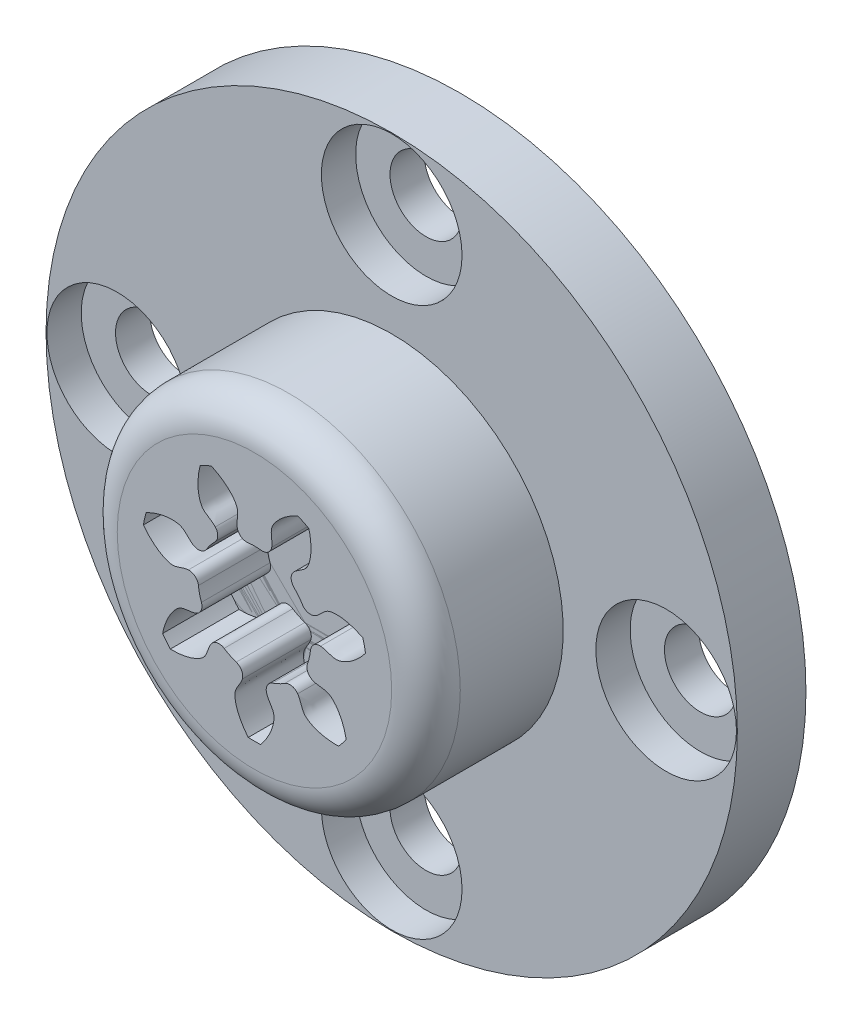
from build123d import *

# Parameters (mm, degrees)
SKETCH_1_R          = 3.285
LASHENA_DEPTH       = 7
CUT_EXTRUDEA_DEPTH  = 7
WWW_KYTOOL_CN_COUNT = 7
SKETCH_3_R          = 5
EXTRUDE_2_DEPTH     = 2
FILLET_1_R          = 1
SKETCH_5_R          = 5
EXTRUDE_3_DEPTH     = 2
SKETCH_7_R          = 10.075
EXTRUDE_4_DEPTH     = 2
SKETCH_8_R          = 1.05
CUT_EXTRUDE_1_DEPTH = 16.100041424
SKETCH_9_R          = 2.05
CUT_EXTRUDE_2_DEPTH = 1
SKETCH_10_R         = 1.05
CUT_EXTRUDE_3_DEPTH = 16.874862248


with BuildPart() as part:
    # 草图1 → LaShenA (new body)
    with BuildSketch(Plane.XY):
        Circle(SKETCH_1_R)
    extrude(amount=LASHENA_DEPTH)

    # SketchA → Cut-ExtrudeA (cut)
    with BuildSketch(Plane.XY.offset(7)):
        with BuildLine():
            ThreePointArc((0.196319602, 1.630725257), (0, 1.6425), (-0.196319602, 1.630725257))
            ThreePointArc((-0.196319602, 1.630725257), (-0.395918985, 1.684219021), (-0.503155758, 1.86085925))
            add(Edge.make_bspline(
                [(-0.503155758, 1.86085925), (-0.529680759, 2.021190092), (-0.456792288, 2.201008016), (-0.510421041, 2.369700657), (-0.518078681, 2.388563402), (-0.525675305, 2.405621476), (-0.535421722, 2.425419167), (-0.547506694, 2.447830289), (-0.562146915, 2.472697504), (-0.579538823, 2.499857985), (-0.599873849, 2.529135411), (-0.623332711, 2.560343137), (-0.650086483, 2.593283802), (-0.68029556, 2.627750094), (-0.714109307, 2.663525183), (-0.751665529, 2.700383298), (-0.793090025, 2.738090277), (-0.838496157, 2.776404166), (-0.887984442, 2.815075822), (-0.941642186, 2.853849544), (-0.999543129, 2.892463716), (-1.061747134, 2.93065147), (-1.128299902, 2.968141365), (-1.199232716, 3.004658075), (-1.274562224, 3.039923097), (-1.354290242, 3.073655461), (-1.438403621, 3.105572452), (-1.526874039, 3.135390364), (-1.652756718, 3.172611828), (-1.750320315, 3.195471796), (-1.816933587, 3.208547948)],
                knots=[0.126986057, 0.126986057, 0.126986057, 0.126986057, 0.327614422, 0.338802919, 0.345100036, 0.352796511, 0.361892345, 0.372387537, 0.384282088, 0.397575998, 0.412269267, 0.428361895, 0.445853881, 0.464745226, 0.48503593, 0.506725993, 0.529815415, 0.554304196, 0.580192335, 0.607479834, 0.636166691, 0.666252907, 0.697738482, 0.730623416, 0.764907708, 0.80059136, 0.83767437, 0.876156739, 0.916038467, 1, 1, 1, 1], degree=3))
            ThreePointArc((-1.816933587, 3.208547948), (0, 3.687279159), (1.816933587, 3.208547948))
            add(Edge.make_bspline(
                [(0.503155758, 1.86085925), (0.529680759, 2.021190092), (0.456792288, 2.201008016), (0.510421041, 2.369700657), (0.518078681, 2.388563402), (0.525675305, 2.405621476), (0.535421722, 2.425419167), (0.547506694, 2.447830289), (0.562146915, 2.472697504), (0.579538823, 2.499857985), (0.599873849, 2.529135411), (0.623332711, 2.560343137), (0.650086483, 2.593283802), (0.68029556, 2.627750094), (0.714109307, 2.663525183), (0.751665529, 2.700383298), (0.793090025, 2.738090277), (0.838496157, 2.776404166), (0.887984442, 2.815075822), (0.941642186, 2.853849544), (0.999543129, 2.892463716), (1.061747134, 2.93065147), (1.128299902, 2.968141365), (1.199232716, 3.004658075), (1.274562224, 3.039923097), (1.354290242, 3.073655461), (1.438403621, 3.105572452), (1.526874039, 3.135390364), (1.652756718, 3.172611828), (1.750320315, 3.195471796), (1.816933587, 3.208547948)],
                knots=[0.126986057, 0.126986057, 0.126986057, 0.126986057, 0.327614422, 0.338802919, 0.345100036, 0.352796511, 0.361892345, 0.372387537, 0.384282088, 0.397575998, 0.412269267, 0.428361895, 0.445853881, 0.464745226, 0.48503593, 0.506725993, 0.529815415, 0.554304196, 0.580192335, 0.607479834, 0.636166691, 0.666252907, 0.697738482, 0.730623416, 0.764907708, 0.80059136, 0.83767437, 0.876156739, 0.916038467, 1, 1, 1, 1], degree=3))
            ThreePointArc((0.503155758, 1.86085925), (0.395918985, 1.684219021), (0.196319602, 1.630725257))
        make_face()
    cut_extrudea = extrude(amount=-CUT_EXTRUDEA_DEPTH, mode=Mode.SUBTRACT)

    # www.KYTool.cn: Cut-ExtrudeA ×7 about axis
    www_kytool_cn_axis = Axis((0, 0, -88.99), (0, 0, 1))
    for i in range(1, WWW_KYTOOL_CN_COUNT):
        add(cut_extrudea.rotate(www_kytool_cn_axis, i * 360 / WWW_KYTOOL_CN_COUNT), mode=Mode.SUBTRACT)


with BuildPart() as body_2:
    # 草图3 → 凸台-拉伸2 (new body)
    with BuildSketch(Plane.XY.offset(7)):
        Circle(SKETCH_3_R)
        with BuildLine():
            ThreePointArc((-1.152549075, 1.170229413), (-1.069924005, 1.35963531), (-1.141165862, 1.553609778))
            add(Edge.make_bspline(
                [(-1.585240621, 2.877192585), (-1.590901783, 2.854798786), (-1.608193217, 2.781661457), (-1.630194526, 2.660897639), (-1.645169392, 2.51902394), (-1.649060212, 2.390007644), (-1.643885461, 2.27463573), (-1.633404916, 2.187515346), (-1.622188627, 2.125144082), (-1.613115282, 2.083688972), (-1.60334246, 2.045890397), (-1.593131129, 2.011737657), (-1.582739887, 1.981205833), (-1.572425943, 1.954255192), (-1.56243908, 1.930833675), (-1.553037413, 1.910869961), (-1.544437291, 1.894295146), (-1.534464264, 1.876547432), (-1.436012027, 1.729440644), (-1.249979495, 1.674312503), (-1.141165862, 1.553609778)],
                knots=[0.126986057, 0.126986057, 0.126986057, 0.126986057, 0.155553883, 0.219924392, 0.278697465, 0.331873103, 0.379451305, 0.421432072, 0.440323418, 0.457815404, 0.473908032, 0.488601301, 0.501895211, 0.513789762, 0.524284954, 0.533380788, 0.541077263, 0.547374379, 0.558562877, 0.759191242, 0.759191242, 0.759191242, 0.759191242], degree=3))
            ThreePointArc((-1.585240621, 2.877192585), (-1.425308083, 2.959682731), (-1.261098383, 3.03329126))
            add(Edge.make_bspline(
                [(-0.503155758, 1.86085925), (-0.529680759, 2.021190092), (-0.456792288, 2.201008016), (-0.510421041, 2.369700657), (-0.518078681, 2.388563402), (-0.525675305, 2.405621476), (-0.535421722, 2.425419167), (-0.547506694, 2.447830289), (-0.562146915, 2.472697504), (-0.579538823, 2.499857985), (-0.599873849, 2.529135411), (-0.623332711, 2.560343137), (-0.650086483, 2.593283802), (-0.68029556, 2.627750094), (-0.714109307, 2.663525183), (-0.765799591, 2.714254631), (-0.823783423, 2.764907187), (-0.906263899, 2.829359948), (-1.001682675, 2.895419492), (-1.126604574, 2.968700711), (-1.215843481, 3.012777704), (-1.261098383, 3.03329126)],
                knots=[0.367794816, 0.367794816, 0.367794816, 0.367794816, 0.56842318, 0.579611678, 0.585908794, 0.593605269, 0.602701103, 0.613196295, 0.625090847, 0.638384757, 0.653078025, 0.669170653, 0.686662639, 0.705553985, 0.725844689, 0.747534752, 0.795112954, 0.821001094, 0.876975449, 0.93854724, 1, 1, 1, 1], degree=3))
            ThreePointArc((-0.503155758, 1.86085925), (-0.395918985, 1.684219021), (-0.196319602, 1.630725257))
            ThreePointArc((-0.196319602, 1.630725257), (0, 1.6425), (0.196319602, 1.630725257))
            ThreePointArc((0.196319602, 1.630725257), (0.395918985, 1.684219021), (0.503155758, 1.86085925))
            add(Edge.make_bspline(
                [(1.261098383, 3.03329126), (1.24006053, 3.023755029), (1.17209843, 2.991673638), (1.063963884, 2.933579944), (0.943705883, 2.856830962), (0.840410995, 2.779432583), (0.753436004, 2.703453588), (0.691857058, 2.640940897), (0.650086483, 2.593283802), (0.623332711, 2.560343137), (0.599873849, 2.529135411), (0.579538823, 2.499857985), (0.562146915, 2.472697504), (0.547506694, 2.447830289), (0.535421722, 2.425419167), (0.525675305, 2.405621476), (0.518078681, 2.388563402), (0.510421041, 2.369700657), (0.456792288, 2.201008016), (0.529680759, 2.021190092), (0.503155758, 1.86085925)],
                knots=[0.126986057, 0.126986057, 0.126986057, 0.126986057, 0.155553883, 0.219924392, 0.278697465, 0.331873103, 0.379451305, 0.421432072, 0.440323418, 0.457815404, 0.473908032, 0.488601301, 0.501895211, 0.513789762, 0.524284954, 0.533380788, 0.541077263, 0.547374379, 0.558562877, 0.759191242, 0.759191242, 0.759191242, 0.759191242], degree=3))
            ThreePointArc((1.261098383, 3.03329126), (1.425308083, 2.959682731), (1.585240621, 2.877192585))
            add(Edge.make_bspline(
                [(1.141165862, 1.553609778), (1.249979495, 1.674312503), (1.436012027, 1.729440644), (1.534464264, 1.876547432), (1.544437291, 1.894295146), (1.553037413, 1.910869961), (1.56243908, 1.930833675), (1.572425943, 1.954255192), (1.582739887, 1.981205833), (1.593131129, 2.011737657), (1.60334246, 2.045890397), (1.613115282, 2.083688972), (1.622188627, 2.125144082), (1.630300407, 2.170251871), (1.637187972, 2.218993927), (1.644621486, 2.291036312), (1.648070922, 2.367951249), (1.647036383, 2.472622721), (1.639191181, 2.588411576), (1.618597215, 2.731769542), (1.597418447, 2.829020885), (1.585240621, 2.877192585)],
                knots=[0.367794816, 0.367794816, 0.367794816, 0.367794816, 0.56842318, 0.579611678, 0.585908794, 0.593605269, 0.602701103, 0.613196295, 0.625090847, 0.638384757, 0.653078025, 0.669170653, 0.686662639, 0.705553985, 0.725844689, 0.747534752, 0.795112954, 0.821001094, 0.876975449, 0.93854724, 1, 1, 1, 1], degree=3))
            ThreePointArc((1.141165862, 1.553609778), (1.069924005, 1.35963531), (1.152549075, 1.170229413))
            ThreePointArc((1.152549075, 1.170229413), (1.28415821, 1.024082), (1.397355615, 0.863251722))
            ThreePointArc((1.397355615, 0.863251722), (1.563626903, 0.740551457), (1.76859083, 0.766843753))
            add(Edge.make_bspline(
                [(3.157804584, 0.905259748), (3.137231971, 0.915762062), (3.069776054, 0.94889455), (2.956935788, 0.997216718), (2.82195138, 1.043386001), (2.697035581, 1.075888097), (2.583404791, 1.096515754), (2.496136557, 1.105684087), (2.432833212, 1.108627925), (2.390398459, 1.109006697), (2.351372915, 1.107889875), (2.31580422, 1.105534263), (2.283725624, 1.102197521), (2.255155624, 1.098139251), (2.230099046, 1.093614557), (2.208543797, 1.088890954), (2.19047084, 1.084194699), (2.170948891, 1.078420954), (2.005622693, 1.01517146), (1.910480598, 0.846070317), (1.76859083, 0.766843753)],
                knots=[0.126986057, 0.126986057, 0.126986057, 0.126986057, 0.155553883, 0.219924392, 0.278697465, 0.331873103, 0.379451305, 0.421432072, 0.440323418, 0.457815404, 0.473908032, 0.488601301, 0.501895211, 0.513789762, 0.524284954, 0.533380788, 0.541077263, 0.547374379, 0.558562877, 0.759191242, 0.759191242, 0.759191242, 0.759191242], degree=3))
            ThreePointArc((3.157804584, 0.905259748), (3.202638192, 0.730981268), (3.237861105, 0.55450921))
            add(Edge.make_bspline(
                [(1.926166313, 0.076460455), (2.088379694, 0.066643449), (2.247469996, -0.044430808), (2.423866681, -0.029684283), (2.443960483, -0.026415992), (2.462281283, -0.02280561), (2.483751387, -0.017708957), (2.508289774, -0.010913924), (2.535791272, -0.00217424), (2.566140846, 0.008737841), (2.599209195, 0.022048186), (2.634854566, 0.037974513), (2.672922614, 0.056727524), (2.713246916, 0.078509725), (2.755649316, 0.103514985), (2.816609041, 0.142620921), (2.878894248, 0.187879723), (2.960084676, 0.253950153), (3.045720645, 0.332276949), (3.144962288, 0.43776019), (3.207791704, 0.514953638), (3.237861105, 0.55450921)],
                knots=[0.367794816, 0.367794816, 0.367794816, 0.367794816, 0.56842318, 0.579611678, 0.585908794, 0.593605269, 0.602701103, 0.613196295, 0.625090847, 0.638384757, 0.653078025, 0.669170653, 0.686662639, 0.705553985, 0.725844689, 0.747534752, 0.795112954, 0.821001094, 0.876975449, 0.93854724, 1, 1, 1, 1], degree=3))
            ThreePointArc((1.926166313, 0.076460455), (1.730092396, 0.01121848), (1.633524791, -0.171473047))
            ThreePointArc((1.633524791, -0.171473047), (1.601319096, -0.365490634), (1.546154349, -0.554267967))
            ThreePointArc((1.546154349, -0.554267967), (1.553891871, -0.760766459), (1.702240935, -0.904620731))
            add(Edge.make_bspline(
                [(2.676619525, -1.904450818), (2.67200375, -1.881818416), (2.655849697, -1.808421488), (2.623274733, -1.690071037), (2.57520993, -1.5557499), (2.522737366, -1.43782207), (2.468017079, -1.336120808), (2.420774316, -1.262175392), (2.383606911, -1.210847391), (2.357445412, -1.177434405), (2.332240216, -1.147619333), (2.308221806, -1.121279308), (2.285612359, -1.098279676), (2.264626372, -1.07847304), (2.245466303, -1.06170412), (2.228333764, -1.047796665), (2.213393779, -1.036594726), (2.196707947, -1.024931723), (2.044178303, -0.935109911), (1.85264958, -0.966157663), (1.702240935, -0.904620731)],
                knots=[0.126986057, 0.126986057, 0.126986057, 0.126986057, 0.155553883, 0.219924392, 0.278697465, 0.331873103, 0.379451305, 0.421432072, 0.440323418, 0.457815404, 0.473908032, 0.488601301, 0.501895211, 0.513789762, 0.524284954, 0.533380788, 0.541077263, 0.547374379, 0.558562877, 0.759191242, 0.759191242, 0.759191242, 0.759191242], degree=3))
            ThreePointArc((2.676619525, -1.904450818), (2.56831642, -2.048163999), (2.452306136, -2.185730911))
            add(Edge.make_bspline(
                [(1.260724243, -1.45826515), (1.354187388, -1.591209481), (1.366537218, -1.784844955), (1.488048049, -1.913563128), (1.503131583, -1.927235349), (1.517377126, -1.939308091), (1.53474824, -1.952916383), (1.555360245, -1.967864633), (1.579340108, -1.983917066), (1.606794167, -2.000841748), (1.637818392, -2.018396759), (1.672494621, -2.03633553), (1.710891355, -2.054406017), (1.753063157, -2.072351846), (1.79905052, -2.089912853), (1.867632539, -2.113190932), (1.941851486, -2.133669066), (2.044128833, -2.15595206), (2.158760341, -2.174068998), (2.303106612, -2.185891514), (2.40263238, -2.186884201), (2.452306136, -2.185730911)],
                knots=[0.367794816, 0.367794816, 0.367794816, 0.367794816, 0.56842318, 0.579611678, 0.585908794, 0.593605269, 0.602701103, 0.613196295, 0.625090847, 0.638384757, 0.653078025, 0.669170653, 0.686662639, 0.705553985, 0.725844689, 0.747534752, 0.795112954, 0.821001094, 0.876975449, 0.93854724, 1, 1, 1, 1], degree=3))
            ThreePointArc((1.260724243, -1.45826515), (1.087465926, -1.345646095), (0.884423022, -1.384052806))
            ThreePointArc((0.884423022, -1.384052806), (0.712654042, -1.479841366), (0.530667322, -1.554412572))
            ThreePointArc((0.530667322, -1.554412572), (0.374044567, -1.689211714), (0.354068896, -1.894887354))
            add(Edge.make_bspline(
                [(0.179885371, -3.280071074), (0.194702207, -3.262351245), (0.242014348, -3.20395926), (0.3142343, -3.104700829), (0.389282879, -2.983374394), (0.448766459, -2.868822892), (0.494162168, -2.762631149), (0.52251964, -2.679591057), (0.53947599, -2.618529925), (0.549287886, -2.577243385), (0.556883066, -2.538947776), (0.562501293, -2.50374669), (0.566386369, -2.471729876), (0.568787272, -2.442973136), (0.569951635, -2.41753794), (0.570142956, -2.395472025), (0.569586057, -2.37680718), (0.568301114, -2.356489908), (0.543425957, -2.181234446), (0.399735641, -2.050849217), (0.354068896, -1.894887354)],
                knots=[0.126986057, 0.126986057, 0.126986057, 0.126986057, 0.155553883, 0.219924392, 0.278697465, 0.331873103, 0.379451305, 0.421432072, 0.440323418, 0.457815404, 0.473908032, 0.488601301, 0.501895211, 0.513789762, 0.524284954, 0.533380788, 0.541077263, 0.547374379, 0.558562877, 0.759191242, 0.759191242, 0.759191242, 0.759191242], degree=3))
            ThreePointArc((0.179885371, -3.280071074), (0, -3.285), (-0.179885371, -3.280071074))
            add(Edge.make_bspline(
                [(-0.354068896, -1.894887354), (-0.399735641, -2.050849217), (-0.543425957, -2.181234446), (-0.568301114, -2.356489908), (-0.569586057, -2.37680718), (-0.570142956, -2.395472025), (-0.569951635, -2.41753794), (-0.568787272, -2.442973136), (-0.566386369, -2.471729876), (-0.562501293, -2.50374669), (-0.556883066, -2.538947776), (-0.549287886, -2.577243385), (-0.53947599, -2.618529925), (-0.527212916, -2.662690208), (-0.512270012, -2.709593686), (-0.487709357, -2.777726912), (-0.457445051, -2.84852153), (-0.411097714, -2.942378398), (-0.35379053, -3.043296646), (-0.273035317, -3.163522324), (-0.21175813, -3.241953633), (-0.179885371, -3.280071074)],
                knots=[0.367794816, 0.367794816, 0.367794816, 0.367794816, 0.56842318, 0.579611678, 0.585908794, 0.593605269, 0.602701103, 0.613196295, 0.625090847, 0.638384757, 0.653078025, 0.669170653, 0.686662639, 0.705553985, 0.725844689, 0.747534752, 0.795112954, 0.821001094, 0.876975449, 0.93854724, 1, 1, 1, 1], degree=3))
            ThreePointArc((-0.354068896, -1.894887354), (-0.374044567, -1.689211714), (-0.530667322, -1.554412572))
            ThreePointArc((-0.530667322, -1.554412572), (-0.712654042, -1.479841366), (-0.884423022, -1.384052806))
            ThreePointArc((-0.884423022, -1.384052806), (-1.087465926, -1.345646095), (-1.260724243, -1.45826515))
            add(Edge.make_bspline(
                [(-2.452306136, -2.185730911), (-2.42921407, -2.186267046), (-2.35406274, -2.186850361), (-2.231430971, -2.181427573), (-2.089782121, -2.16445712), (-1.963134744, -2.139541563), (-1.851806935, -2.108823888), (-1.769202982, -2.079220002), (-1.710891355, -2.054406017), (-1.672494621, -2.03633553), (-1.637818392, -2.018396759), (-1.606794167, -2.000841748), (-1.579340108, -1.983917066), (-1.555360245, -1.967864633), (-1.53474824, -1.952916383), (-1.517377126, -1.939308091), (-1.503131583, -1.927235349), (-1.488048049, -1.913563128), (-1.366537218, -1.784844955), (-1.354187388, -1.591209481), (-1.260724243, -1.45826515)],
                knots=[0.126986057, 0.126986057, 0.126986057, 0.126986057, 0.155553883, 0.219924392, 0.278697465, 0.331873103, 0.379451305, 0.421432072, 0.440323418, 0.457815404, 0.473908032, 0.488601301, 0.501895211, 0.513789762, 0.524284954, 0.533380788, 0.541077263, 0.547374379, 0.558562877, 0.759191242, 0.759191242, 0.759191242, 0.759191242], degree=3))
            ThreePointArc((-2.452306136, -2.185730911), (-2.56831642, -2.048163999), (-2.676619525, -1.904450818))
            add(Edge.make_bspline(
                [(-1.702240935, -0.904620731), (-1.85264958, -0.966157663), (-2.044178303, -0.935109911), (-2.196707947, -1.024931723), (-2.213393779, -1.036594726), (-2.228333764, -1.047796665), (-2.245466303, -1.06170412), (-2.264626372, -1.07847304), (-2.285612359, -1.098279676), (-2.308221806, -1.121279308), (-2.332240216, -1.147619333), (-2.357445412, -1.177434405), (-2.383606911, -1.210847391), (-2.410486909, -1.247968535), (-2.437840776, -1.288895208), (-2.47579616, -1.350577872), (-2.512276134, -1.418379182), (-2.556759297, -1.513133789), (-2.599929916, -1.620859848), (-2.643576084, -1.7589563), (-2.66669045, -1.855765855), (-2.676619525, -1.904450818)],
                knots=[0.367794816, 0.367794816, 0.367794816, 0.367794816, 0.56842318, 0.579611678, 0.585908794, 0.593605269, 0.602701103, 0.613196295, 0.625090847, 0.638384757, 0.653078025, 0.669170653, 0.686662639, 0.705553985, 0.725844689, 0.747534752, 0.795112954, 0.821001094, 0.876975449, 0.93854724, 1, 1, 1, 1], degree=3))
            ThreePointArc((-1.702240935, -0.904620731), (-1.553891871, -0.760766459), (-1.546154349, -0.554267967))
            ThreePointArc((-1.546154349, -0.554267967), (-1.601319096, -0.365490634), (-1.633524791, -0.171473047))
            ThreePointArc((-1.633524791, -0.171473047), (-1.730092396, 0.01121848), (-1.926166313, 0.076460455))
            add(Edge.make_bspline(
                [(-3.237861105, 0.55450921), (-3.223882605, 0.53612083), (-3.177482571, 0.477001464), (-3.096783207, 0.384505139), (-2.995198559, 0.284340512), (-2.896755445, 0.200858202), (-2.803327645, 0.132970773), (-2.728679673, 0.086846123), (-2.672922614, 0.056727524), (-2.634854566, 0.037974513), (-2.599209195, 0.022048186), (-2.566140846, 0.008737841), (-2.535791272, -0.00217424), (-2.508289774, -0.010913924), (-2.483751387, -0.017708957), (-2.462281283, -0.02280561), (-2.443960483, -0.026415992), (-2.423866681, -0.029684283), (-2.247469996, -0.044430808), (-2.088379694, 0.066643449), (-1.926166313, 0.076460455)],
                knots=[0.126986057, 0.126986057, 0.126986057, 0.126986057, 0.155553883, 0.219924392, 0.278697465, 0.331873103, 0.379451305, 0.421432072, 0.440323418, 0.457815404, 0.473908032, 0.488601301, 0.501895211, 0.513789762, 0.524284954, 0.533380788, 0.541077263, 0.547374379, 0.558562877, 0.759191242, 0.759191242, 0.759191242, 0.759191242], degree=3))
            ThreePointArc((-3.237861105, 0.55450921), (-3.202638192, 0.730981268), (-3.157804584, 0.905259748))
            add(Edge.make_bspline(
                [(-1.76859083, 0.766843753), (-1.910480598, 0.846070317), (-2.005622693, 1.01517146), (-2.170948891, 1.078420954), (-2.19047084, 1.084194699), (-2.208543797, 1.088890954), (-2.230099046, 1.093614557), (-2.255155624, 1.098139251), (-2.283725624, 1.102197521), (-2.31580422, 1.105534263), (-2.351372915, 1.107889875), (-2.390398459, 1.109006697), (-2.432833212, 1.108627925), (-2.478615095, 1.106498899), (-2.527667713, 1.10236765), (-2.599557957, 1.093583852), (-2.675312048, 1.079831619), (-2.777128981, 1.055531425), (-2.888269046, 1.022117475), (-3.02345014, 0.970139694), (-3.11355047, 0.927851462), (-3.157804584, 0.905259748)],
                knots=[0.367794816, 0.367794816, 0.367794816, 0.367794816, 0.56842318, 0.579611678, 0.585908794, 0.593605269, 0.602701103, 0.613196295, 0.625090847, 0.638384757, 0.653078025, 0.669170653, 0.686662639, 0.705553985, 0.725844689, 0.747534752, 0.795112954, 0.821001094, 0.876975449, 0.93854724, 1, 1, 1, 1], degree=3))
            ThreePointArc((-1.76859083, 0.766843753), (-1.563626903, 0.740551457), (-1.397355615, 0.863251722))
            ThreePointArc((-1.397355615, 0.863251722), (-1.28415821, 1.024082), (-1.152549075, 1.170229413))
        make_face(mode=Mode.SUBTRACT)
    extrude(amount=EXTRUDE_2_DEPTH)

    # 圆角1
    fillet_1_edges = [body_2.edges().sort_by_distance(p)[0] for p in [
        (-5, 0, 9),
    ]]
    fillet(fillet_1_edges, radius=FILLET_1_R)

    # 草图5 → 凸台-拉伸3 (add)
    with BuildSketch(Plane(origin=(0, 0, 7), x_dir=(-1, 0, 0), z_dir=(0, 0, -1))):
        Circle(SKETCH_5_R)
    extrude(amount=EXTRUDE_3_DEPTH)

    # 草图7 → 凸台-拉伸4 (add)
    with BuildSketch(Plane(origin=(0, 0, 5), x_dir=(-1, 0, 0), z_dir=(0, 0, -1))):
        Circle(SKETCH_7_R)
    extrude(amount=EXTRUDE_4_DEPTH)

    # 草图8 → 切除-拉伸1 (cut, through all)
    with BuildSketch(Plane.XY.offset(5)):
        with Locations((8, 0)):
            Circle(SKETCH_8_R)
        with Locations((0, -8)):
            Circle(SKETCH_8_R)
        with Locations((-8, 0)):
            Circle(SKETCH_8_R)
        with Locations((0, 8)):
            Circle(SKETCH_8_R)
    extrude(amount=-CUT_EXTRUDE_1_DEPTH, mode=Mode.SUBTRACT)

    # 草图9 → 切除-拉伸2 (cut)
    with BuildSketch(Plane.XY.offset(5)):
        with Locations((0, 8)):
            Circle(SKETCH_9_R)
        with Locations((8, 0)):
            Circle(SKETCH_9_R)
        with Locations((0, -8)):
            Circle(SKETCH_9_R)
        with Locations((-8, 0)):
            Circle(SKETCH_9_R)
    extrude(amount=-CUT_EXTRUDE_2_DEPTH, mode=Mode.SUBTRACT)

    # 草图10 → 切除-拉伸3 (cut, through all)
    with BuildSketch(Plane.XY.offset(7)):
        Circle(SKETCH_10_R)
    extrude(amount=-CUT_EXTRUDE_3_DEPTH, mode=Mode.SUBTRACT)


solid = Compound([part.part, body_2.part])
